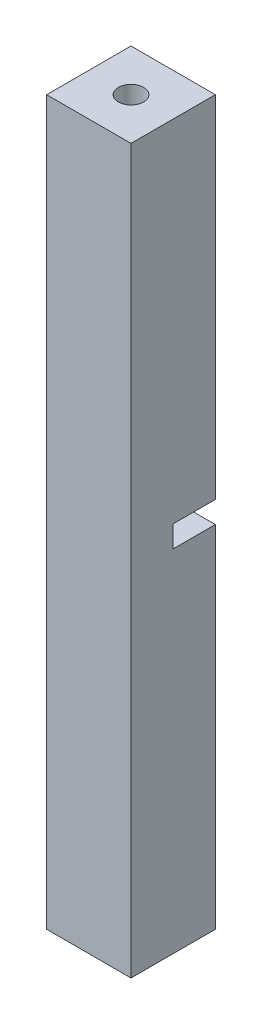
from build123d import *

# Parameters (mm, degrees)
SKETCH1_R               = 3.5
SKETCH1_R_2             = 1.05
BOSS_EXTRUDE1_DEPTH     = 60
CUT_EXTRUDE1_DEPTH      = 0.9
CUT_EXTRUDE1_DEPTH_BACK = 0.9
CUT_EXTRUDE1_START      = -30
SKETCH3_R               = 3.05
CUT_EXTRUDE2_DEPTH      = 0.9
CUT_EXTRUDE2_DEPTH_BACK = 0.9
CUT_EXTRUDE2_START      = -30
SKETCH5_W               = 7
SKETCH5_H               = 7
SKETCH5_R               = 1.05
BOSS_EXTRUDE2_DEPTH     = 60
CUT_EXTRUDE3_DEPTH      = 0.9
CUT_EXTRUDE3_DEPTH_BACK = 0.9
CUT_EXTRUDE3_START      = -30
SKETCH6_R               = 3.05
CUT_EXTRUDE4_DEPTH      = 0.9
CUT_EXTRUDE4_DEPTH_BACK = 0.9
CUT_EXTRUDE4_START      = -30
SKETCH7_W               = 8.533306348
SKETCH7_H               = 4.274424856


with BuildPart() as part:
    # Sketch1 → Boss-Extrude1 (new body)
    with BuildSketch(Plane(origin=(0, 0, 0), x_dir=(1, 0, 0), z_dir=(0, 1, 0))):
        with Locations(Location((0, 0, 0), (0, 0, 270))):
            Circle(SKETCH1_R)
        with Locations(Location((0, 0, 0), (0, 0, 270))):
            Circle(SKETCH1_R_2, mode=Mode.SUBTRACT)
    extrude(amount=BOSS_EXTRUDE1_DEPTH)

    # Sketch3 → Cut-Extrude1 (cut, two sides: drawn at the far end of the back side and taken through both)
    with BuildSketch(Plane(origin=(0, 60, 0), x_dir=(1, 0, 0), z_dir=(0, 1, 0)).offset(CUT_EXTRUDE1_START - CUT_EXTRUDE1_DEPTH_BACK)):
        with Locations(Location((0, 0, 0), (0, 0, 270))):
            Circle(SKETCH3_R)
    extrude(amount=CUT_EXTRUDE1_DEPTH + CUT_EXTRUDE1_DEPTH_BACK, mode=Mode.SUBTRACT)

    # Sketch4 → Cut-Extrude2 (cut, two sides: drawn at the far end of the back side and taken through both)
    with BuildSketch(Plane(origin=(0, 60, 0), x_dir=(1, 0, 0), z_dir=(0, 1, 0)).offset(CUT_EXTRUDE2_START - CUT_EXTRUDE2_DEPTH_BACK)):
        with BuildLine():
            Line((-4.266653174, 0), (4.266653174, 0))
            ThreePointArc((4.266653174, 0), (0, 4.266653174), (-4.266653174, 0))
        make_face()
    extrude(amount=CUT_EXTRUDE2_DEPTH + CUT_EXTRUDE2_DEPTH_BACK, mode=Mode.SUBTRACT)

    # Sketch5 → Boss-Extrude2 (add)
    with BuildSketch(Plane.XZ):
        Rectangle(SKETCH5_W, SKETCH5_H)
        with Locations(Location((0, 0, 0), (0, 0, 90))):
            Circle(SKETCH5_R, mode=Mode.SUBTRACT)
    extrude(amount=-BOSS_EXTRUDE2_DEPTH)

    # Sketch6 → Cut-Extrude3 (cut, two sides: drawn at the far end of the back side and taken through both)
    with BuildSketch(Plane(origin=(0, 60, 0), x_dir=(1, 0, 0), z_dir=(0, 1, 0)).offset(CUT_EXTRUDE3_START - CUT_EXTRUDE3_DEPTH_BACK)):
        with Locations(Location((0, 0, 0), (0, 0, 270))):
            Circle(SKETCH6_R)
    extrude(amount=CUT_EXTRUDE3_DEPTH + CUT_EXTRUDE3_DEPTH_BACK, mode=Mode.SUBTRACT)

    # Sketch7 → Cut-Extrude4 (cut, two sides: drawn at the far end of the back side and taken through both)
    with BuildSketch(Plane(origin=(0, 60, 0), x_dir=(1, 0, 0), z_dir=(0, 1, 0)).offset(CUT_EXTRUDE4_START - CUT_EXTRUDE4_DEPTH_BACK)):
        with Locations((0, 2.137212428)):
            Rectangle(SKETCH7_W, SKETCH7_H)
    extrude(amount=CUT_EXTRUDE4_DEPTH + CUT_EXTRUDE4_DEPTH_BACK, mode=Mode.SUBTRACT)


solid = part.part
